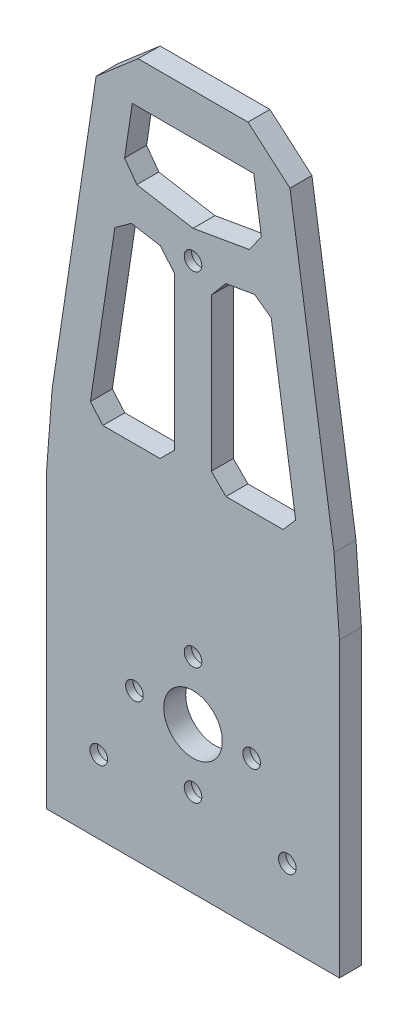
from build123d import *

# Parameters (mm, degrees)
EXTRUDE_1_DEPTH              = 3
CUT_EXTRUDE_1_REACH          = 104.025
SKETCH_2_W                   = 5
SKETCH_2_H                   = 10
HOLE_WIZARD_M2_1_D           = 2.4
HOLE_WIZARD_M2_1_CBORE_D     = 4.4
HOLE_WIZARD_M2_1_CBORE_DEPTH = 2
CUT_EXTRUDE_2_REACH          = 104.025
SKETCH_5_R                   = 4
HOLE_WIZARD_M2_2_D           = 2.4
HOLE_WIZARD_M2_2_CBORE_D     = 4.4
HOLE_WIZARD_M2_2_CBORE_DEPTH = 2
HOLE_WIZARD_M2_3_D           = 2.4
HOLE_WIZARD_M2_3_CBORE_D     = 4.4
HOLE_WIZARD_M2_3_CBORE_DEPTH = 2
CUT_EXTRUDE_3_DEPTH          = 3
HOLE_WIZARD_M2_5_D           = 2.4
HOLE_WIZARD_M2_5_CBORE_D     = 4.4
HOLE_WIZARD_M2_5_CBORE_DEPTH = 2
HOLE_WIZARD_M2_6_D           = 2.4
HOLE_WIZARD_M2_6_CBORE_D     = 4.4
HOLE_WIZARD_M2_6_CBORE_DEPTH = 2
SKETCH_17_OUTSIDE_W          = 82.796
SKETCH_17_OUTSIDE_H          = 242.796
CUT_EXTRUDE_4_DEPTH          = 10


with BuildPart() as part:
    # 草图1 → 凸台-拉伸1 (new body)
    with BuildSketch(Plane.XY):
        Polygon((20, 5), (20, 45), (19.258297735, 54.944681764), (13.241702265, 95.055318236), (7.5, 100), (-7.5, 100), (-13.241702265, 95.055318236), (-19.258297735, 54.944681764), (-20, 45), (-20, 5), (-19.379826327, -4.961389384), (-7.748069469, -98.015444247), (-5.5, -100), (5.5, -100), (7.748069469, -98.015444247), (19.379826327, -4.961389384), align=None)
    extrude(amount=EXTRUDE_1_DEPTH)

    # 草图2 → 切除-拉伸1 (cut, up to next)
    with BuildSketch(Plane.XY.offset(3), mode=Mode.PRIVATE) as cut_extrude_1_sk1:
        Polygon((10, -5), (-10, -5), (0, -22.320508076), align=None)
    cut_extrude_1_tool1 = extrude(cut_extrude_1_sk1.sketch, amount=-CUT_EXTRUDE_1_REACH, mode=Mode.PRIVATE) & part.part
    # 草图2 → 切除-拉伸1 (cut, up to next)
    with BuildSketch(Plane.XY.offset(3), mode=Mode.PRIVATE) as cut_extrude_1_sk2:
        Polygon((6.211088907, -70), (13.938881842, -8.177656525), (2.5, -27.990381057), (2.5, -70), align=None)
    cut_extrude_1_tool2 = extrude(cut_extrude_1_sk2.sketch, amount=-CUT_EXTRUDE_1_REACH, mode=Mode.PRIVATE) & part.part
    # 草图2 → 切除-拉伸1 (cut, up to next)
    with BuildSketch(Plane.XY.offset(3), mode=Mode.PRIVATE) as cut_extrude_1_sk3:
        Polygon((-13.938881842, -8.177656525), (-2.5, -27.990381057), (-2.5, -70), (-6.211088907, -70), align=None)
    cut_extrude_1_tool3 = extrude(cut_extrude_1_sk3.sketch, amount=-CUT_EXTRUDE_1_REACH, mode=Mode.PRIVATE) & part.part
    # 草图2 → 切除-拉伸1 (cut, up to next)
    with BuildSketch(Plane.XY.offset(3), mode=Mode.PRIVATE) as cut_extrude_1_sk4:
        with Locations((0, -85)):
            Rectangle(SKETCH_2_W, SKETCH_2_H)
    cut_extrude_1_tool4 = extrude(cut_extrude_1_sk4.sketch, amount=-CUT_EXTRUDE_1_REACH, mode=Mode.PRIVATE) & part.part
    add(cut_extrude_1_tool1.solids().sort_by_distance((0, -10.773503, 3))[0], mode=Mode.SUBTRACT)
    add(cut_extrude_1_tool2.solids().sort_by_distance((6.712708, -39.914502, 3))[0], mode=Mode.SUBTRACT)
    add(cut_extrude_1_tool3.solids().sort_by_distance((-6.712708, -39.914502, 3))[0], mode=Mode.SUBTRACT)
    add(cut_extrude_1_tool4.solids().sort_by_distance((0, -85, 3))[0], mode=Mode.SUBTRACT)

    # M2 凹头盖螺钉的柱形沉头孔1 (through all)
    with Locations(Plane(origin=(5.586088907, -75, 0), x_dir=(-1, 0, 0), z_dir=(0, 0, -1))):
        with Locations((0, 0), (11.172177814, 0)):
            CounterBoreHole(HOLE_WIZARD_M2_1_D / 2, HOLE_WIZARD_M2_1_CBORE_D / 2, HOLE_WIZARD_M2_1_CBORE_DEPTH)

    # 草图5 → 切除-拉伸2 (cut, up to next)
    with BuildSketch(Plane(origin=(0, 0, 0), x_dir=(-1, 0, 0), z_dir=(0, 0, -1)), mode=Mode.PRIVATE) as cut_extrude_2_sk1:
        with Locations((0, 25)):
            Circle(SKETCH_5_R)
    cut_extrude_2_tool1 = extrude(cut_extrude_2_sk1.sketch, amount=-CUT_EXTRUDE_2_REACH, mode=Mode.PRIVATE) & part.part
    add(cut_extrude_2_tool1.solids().sort_by_distance((0, 25, 0))[0], mode=Mode.SUBTRACT)

    # M2 凹头盖螺钉的柱形沉头孔2 (through all)
    with Locations(Plane(origin=(8, 25, 0), x_dir=(-1, 0, 0), z_dir=(0, 0, -1))):
        with Locations((0, 0), (8, 8), (16, 0), (8, -8)):
            CounterBoreHole(HOLE_WIZARD_M2_2_D / 2, HOLE_WIZARD_M2_2_CBORE_D / 2, HOLE_WIZARD_M2_2_CBORE_DEPTH)

    # M2 凹头盖螺钉的柱形沉头孔3 (through all)
    with Locations(Plane(origin=(12.880020708, -5.011657807, 0), x_dir=(-1, 0, 0), z_dir=(0, 0, -1))):
        with Locations((0, 0), (25.760041416, 0)):
            CounterBoreHole(HOLE_WIZARD_M2_3_D / 2, HOLE_WIZARD_M2_3_CBORE_D / 2, HOLE_WIZARD_M2_3_CBORE_DEPTH)

    # 草图10 → 切除-拉伸3 (cut)
    with BuildSketch(Plane(origin=(0, 0, 0), x_dir=(-1, 0, 0), z_dir=(0, 0, -1))):
        Polygon((-14.016935065, 56.180852205), (-10.679274874, 78.431920145), (-8.411945476, 80.068406675), (-4.470648492, 79.385634325), (-2.5, 77.04424815), (-2.5, 56.2029795), (-4.5, 54.2029795), (-12.313615971, 54.2029795), align=None)
        Polygon((-9.344020618, 87.333615184), (-8.2970205, 94.313615971), (0, 94.313615971), (8.2970205, 94.313615971), (9.344020618, 87.333615184), (7.670053032, 85.014356303), (0, 83.685631227), (-7.670053032, 85.014356303), align=None)
        Polygon((4.5, 54.2029795), (12.313615971, 54.2029795), (14.016935065, 56.180852205), (10.679274874, 78.431920145), (8.411945476, 80.068406675), (4.470648492, 79.385634325), (2.5, 77.04424815), (2.5, 56.2029795), align=None)
    extrude(amount=-CUT_EXTRUDE_3_DEPTH, mode=Mode.SUBTRACT)

    # M2 凹头盖螺钉的柱形沉头孔5 (through all)
    with Locations(Plane(origin=(0, 79.840052868, 0), x_dir=(-1, 0, 0), z_dir=(0, 0, -1))):
        with Locations((0, 0)):
            CounterBoreHole(HOLE_WIZARD_M2_5_D / 2, HOLE_WIZARD_M2_5_CBORE_D / 2, HOLE_WIZARD_M2_5_CBORE_DEPTH)

    # M2 凹头盖螺钉的柱形沉头孔6 (through all)
    with Locations(Plane(origin=(12.880020708, 14.988342193, 0), x_dir=(-1, 0, 0), z_dir=(0, 0, -1))):
        with Locations((0, 0), (25.760041416, 0)):
            CounterBoreHole(HOLE_WIZARD_M2_6_D / 2, HOLE_WIZARD_M2_6_CBORE_D / 2, HOLE_WIZARD_M2_6_CBORE_DEPTH)

    # 草图17 outside → 切除-拉伸4 (cut)
    with BuildSketch(Plane(origin=(0, 0, 0), x_dir=(-1, 0, 0), z_dir=(0, 0, -1))):
        Rectangle(SKETCH_17_OUTSIDE_W, SKETCH_17_OUTSIDE_H)
        Polygon((-20, 5), (20, 5), (20, 99.998273705), (7.5, 100), (-7.5, 100), (-20, 99.998273705), align=None, mode=Mode.SUBTRACT)
    extrude(amount=-CUT_EXTRUDE_4_DEPTH, mode=Mode.SUBTRACT)


solid = part.part
